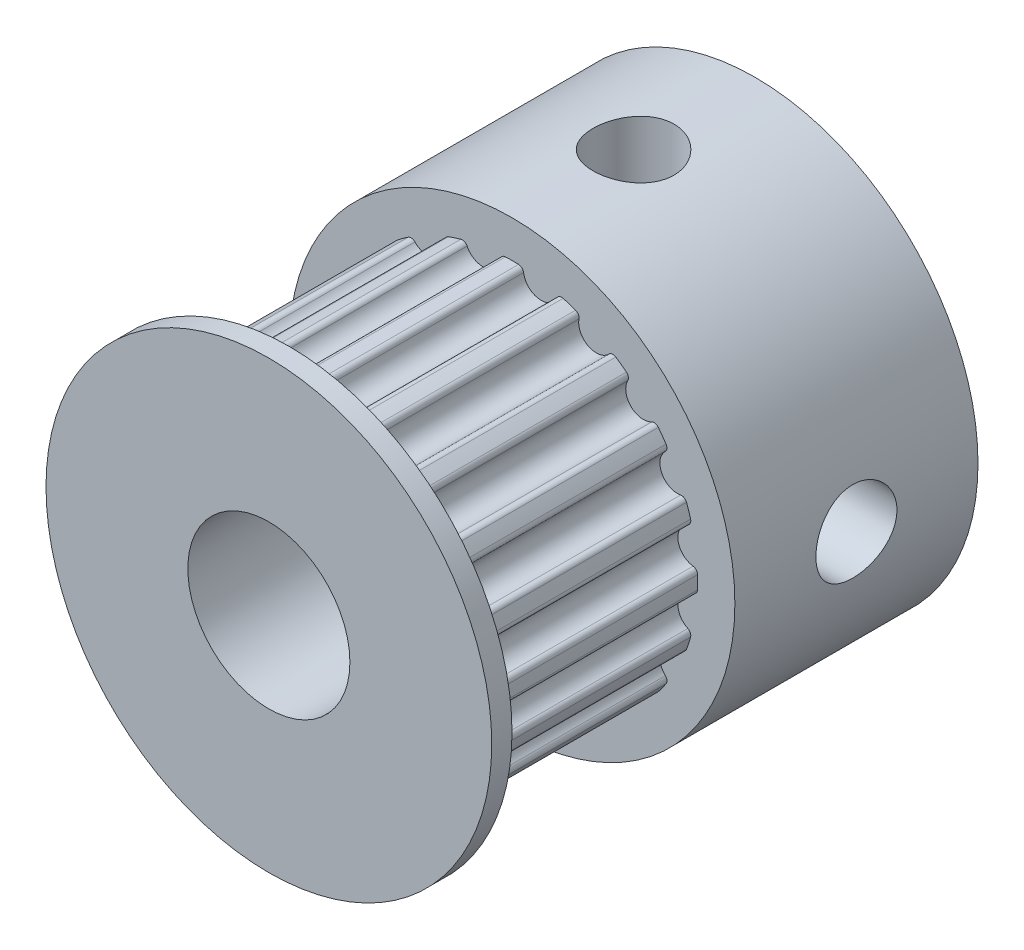
from build123d import *

# Parameters (mm, degrees)
SKETCH1_R           = 9.168296586
BOSS_EXTRUDE1_DEPTH = 5.5
CUT_EXTRUDE1_DEPTH  = 18.003391561
CIRPATTERN1_COUNT   = 20
SKETCH3_R           = 11
BOSS_EXTRUDE2_DEPTH = 1
BOSS_EXTRUDE3_START = 12
SKETCH4_R           = 11
BOSS_EXTRUDE3_DEPTH = 12
SKETCH6_R           = 4
CUT_EXTRUDE2_DEPTH  = 29.600699292
SKETCH7_R           = 2
CUT_EXTRUDE3_DEPTH  = 24.414738948
CIRPATTERN2_COUNT   = 2
CIRPATTERN2_ANGLE   = 90


with BuildPart() as part:
    # Sketch1 → Boss-Extrude1 (new, symmetric)
    with BuildSketch(Plane.XY):
        Circle(SKETCH1_R)
    extrude(amount=BOSS_EXTRUDE1_DEPTH, both=True)

    # Sketch2 → Cut-Extrude1 (cut, symmetric)
    with BuildSketch(Plane.XY.offset(5.5)):
        with BuildLine():
            Line((-1.298139587, 8.196130784), (-1.434237572, 9.055419641))
            Line((-1.434237572, 9.055419641), (-1.434237572, 10.502085024))
            Line((-1.434237572, 10.502085024), (1.434237572, 10.502085024))
            Line((1.434237572, 10.502085024), (1.434237572, 9.055419641))
            Line((1.434237572, 9.055419641), (1.298139587, 8.196130784))
            ThreePointArc((1.298139587, 8.196130784), (0.812461867, 8.446900969), (0.572215532, 8.937869636))
            ThreePointArc((0.572215532, 8.937869636), (0.48900926, 9.095564341), (0.323781745, 9.162577566))
            ThreePointArc((0.323781745, 9.162577566), (0, 9.168296586), (-0.323781745, 9.162577566))
            ThreePointArc((-0.323781745, 9.162577566), (-0.48900926, 9.095564341), (-0.572215532, 8.937869636))
            ThreePointArc((-0.572215532, 8.937869636), (-0.812461867, 8.446900969), (-1.298139587, 8.196130784))
        make_face()
    cut_extrude1 = extrude(amount=CUT_EXTRUDE1_DEPTH, both=True, mode=Mode.SUBTRACT)

    # CirPattern1: Cut-Extrude1 ×20 about axis
    cirpattern1_axis = Axis((0, 0, 0), (0, 0, 1))
    for i in range(1, CIRPATTERN1_COUNT):
        add(cut_extrude1.rotate(cirpattern1_axis, i * 360 / CIRPATTERN1_COUNT), mode=Mode.SUBTRACT)

    # Sketch3 → Boss-Extrude2 (add)
    with BuildSketch(Plane.XY.offset(5.5)):
        Circle(SKETCH3_R)
    extrude(amount=BOSS_EXTRUDE2_DEPTH)

    # Sketch4 → Boss-Extrude3 (add)
    with BuildSketch(Plane(origin=(0, 0, -5.5), x_dir=(-1, 0, 0), z_dir=(0, 0, -1)).offset(BOSS_EXTRUDE3_START)):
        with Locations(Location((0, 0, 0), (0, 0, 180))):
            Circle(SKETCH4_R)
    extrude(amount=-BOSS_EXTRUDE3_DEPTH)

    # Sketch6 → Cut-Extrude2 (cut, through all)
    with BuildSketch(Plane.XY.offset(6.5)):
        Circle(SKETCH6_R)
    extrude(amount=-CUT_EXTRUDE2_DEPTH, mode=Mode.SUBTRACT)

    # Sketch7 → Cut-Extrude3 (cut, through all)
    with BuildSketch(Plane(origin=(0, 0, 0), x_dir=(0, 0, -1), z_dir=(1, 0, 0))):
        with Locations(Location((11.5, 0, 0), (0, 0, 180))):
            Circle(SKETCH7_R)
    cut_extrude3 = extrude(amount=CUT_EXTRUDE3_DEPTH, mode=Mode.SUBTRACT)

    # CirPattern2: Cut-Extrude3 ×2 about axis
    cirpattern2_axis = Axis((0, 0, -17.5), (0, 0, 1))
    for i in range(1, CIRPATTERN2_COUNT):
        add(cut_extrude3.rotate(cirpattern2_axis, i * CIRPATTERN2_ANGLE / (CIRPATTERN2_COUNT - 1)), mode=Mode.SUBTRACT)


solid = part.part
